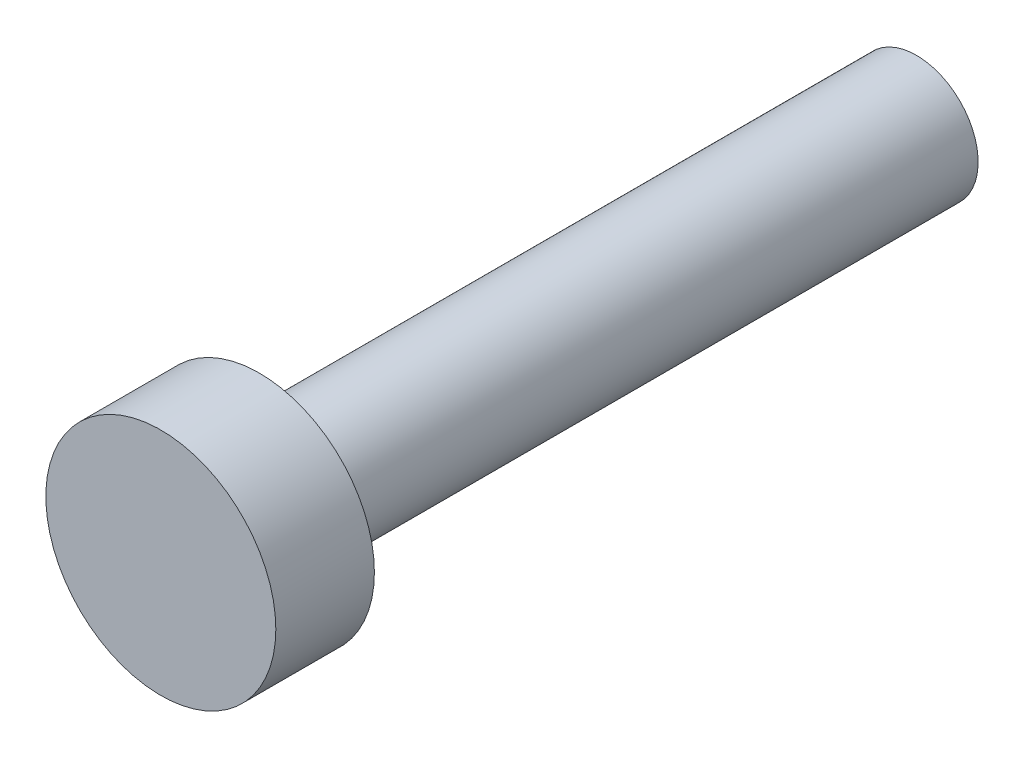
from build123d import *

# Parameters (mm, degrees)
ESQUISSE1_R        = 2.8
BOSS_EXTRU_1_DEPTH = 2.4
ESQUISSE2_R        = 1.5
BOSS_EXTRU_2_DEPTH = 16


with BuildPart() as part:
    # Esquisse1 → Boss.-Extru.1 (new body)
    with BuildSketch(Plane.XY):
        Circle(ESQUISSE1_R)
    extrude(amount=BOSS_EXTRU_1_DEPTH)

    # Esquisse2 → Boss.-Extru.2 (add)
    with BuildSketch(Plane(origin=(0, 0, 0), x_dir=(-1, 0, 0), z_dir=(0, 0, -1))):
        Circle(ESQUISSE2_R)
    extrude(amount=BOSS_EXTRU_2_DEPTH)


solid = part.part
